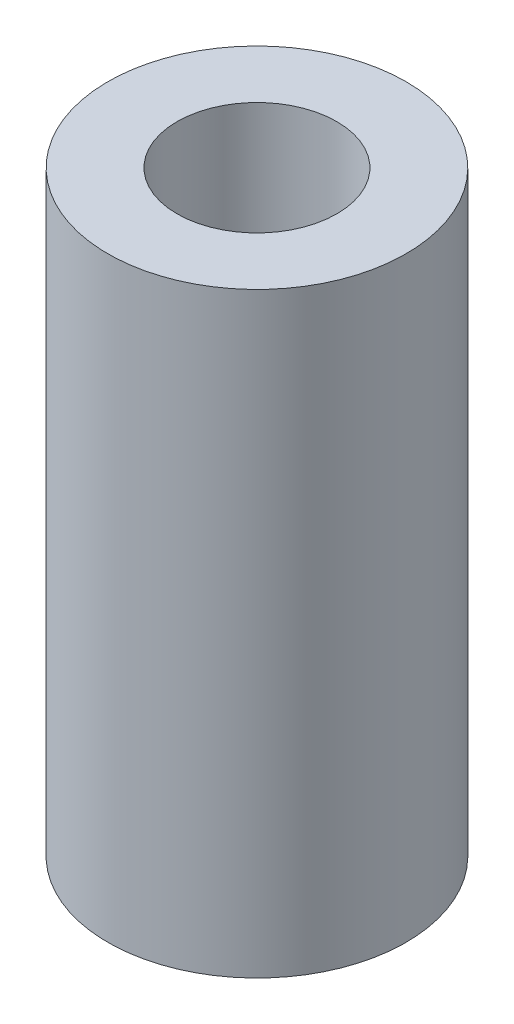
from build123d import *

# Parameters (mm, degrees)
SKETCH1_R           = 4.7625
SKETCH1_R_2         = 2.5527
BOSS_EXTRUDE1_DEPTH = 19.05


with BuildPart() as part:
    # Sketch1 → Boss-Extrude1 (new body)
    with BuildSketch(Plane(origin=(0, 0, 0), x_dir=(1, 0, 0), z_dir=(0, 1, 0))):
        with Locations(Location((0, 0, 0), (0, 0, 90))):
            Circle(SKETCH1_R)
        with Locations(Location((0, 0, 0), (0, 0, 90))):
            Circle(SKETCH1_R_2, mode=Mode.SUBTRACT)
    extrude(amount=BOSS_EXTRUDE1_DEPTH)


solid = part.part
